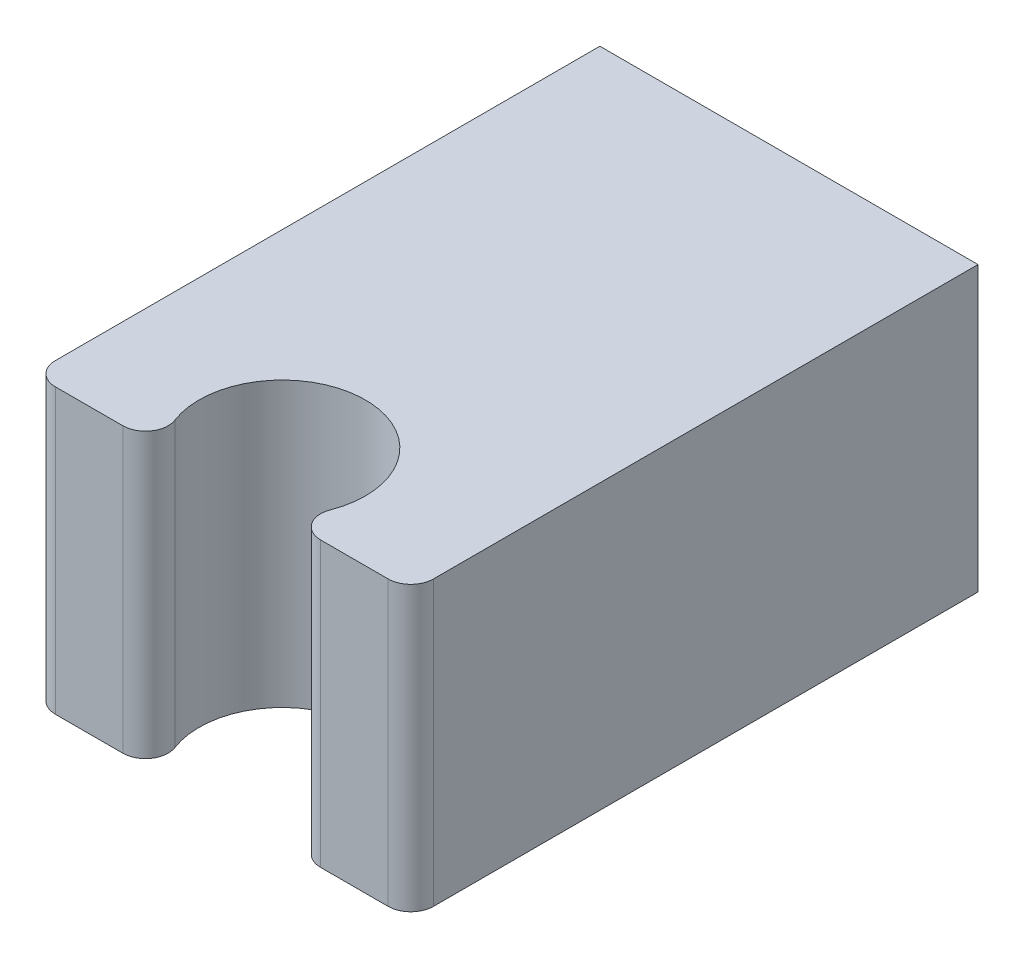
from build123d import *

# Parameters (mm, degrees)
BOSS_EXTRUDE1_DEPTH      = 10
BOSS_EXTRUDE1_DEPTH_BACK = 5
SKETCH1_W                = 7.5
SKETCH1_H                = 10
SKETCH2_R                = 2.2
CUT_EXTRUDE1_DEPTH       = 14.462912018
FILLET1_R                = 0.6


with BuildPart() as part:
    # Sketch1 → Boss-Extrude1 (new, two sides: drawn at the far end of the back side and taken through both)
    with BuildSketch(Plane(origin=(0, 0, 0), x_dir=(0, 1, 0), z_dir=(0, 0, 1)).offset(-BOSS_EXTRUDE1_DEPTH_BACK)):
        Rectangle(SKETCH1_W, SKETCH1_H)
    extrude(amount=BOSS_EXTRUDE1_DEPTH + BOSS_EXTRUDE1_DEPTH_BACK)

    # Sketch2 → Cut-Extrude1 (cut, through all)
    with BuildSketch(Plane(origin=(0, 3.75, 0), x_dir=(-1, 0, 0), z_dir=(0, 1, 0))):
        with Locations((0, 8.4)):
            Circle(SKETCH2_R)
    extrude(amount=-CUT_EXTRUDE1_DEPTH, mode=Mode.SUBTRACT)

    # Fillet1
    fillet1_edges = [part.edges().sort_by_distance(p)[0] for p in [
        (-5, 0, 10),
        (5, 0, 10),
        (-1.509966887, 0, 10),
        (1.509966887, 0, 10),
    ]]
    fillet(fillet1_edges, radius=FILLET1_R)


solid = part.part
